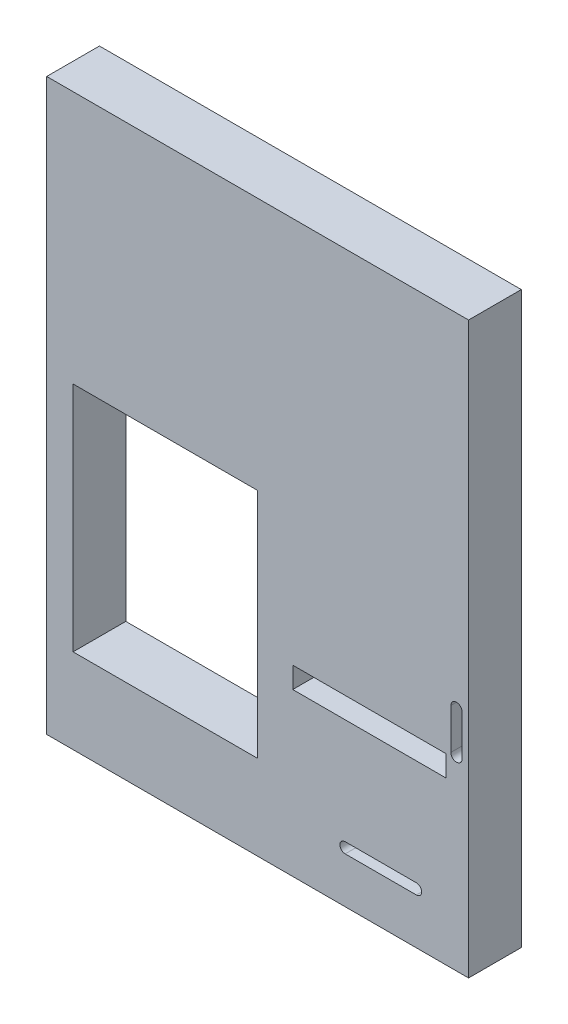
from build123d import *

# Parameters (mm, degrees)
SKETCH1_W           = 200
SKETCH1_H           = 240
BOSS_EXTRUDE3_DEPTH = 25
SKETCH3_W           = 87.5
SKETCH3_H           = 110
CUT_EXTRUDE1_DEPTH  = 25
SKETCH4_W           = 200
SKETCH4_H           = 30.164162566
BOSS_EXTRUDE4_DEPTH = 25
CUT_EXTRUDE3_DEPTH  = 40
CUT_EXTRUDE4_DEPTH  = 40
SKETCH8_W           = 72.718372575
SKETCH8_H           = 10
CUT_EXTRUDE5_DEPTH  = 40


with BuildPart() as part:
    # Sketch1 → Boss-Extrude3 (new body)
    with BuildSketch(Plane.XY):
        Rectangle(SKETCH1_W, SKETCH1_H)
    extrude(amount=BOSS_EXTRUDE3_DEPTH)

    # Sketch3 → Cut-Extrude1 (cut)
    with BuildSketch(Plane.XY.offset(25)):
        with Locations((-43.75, -55)):
            Rectangle(SKETCH3_W, SKETCH3_H)
    extrude(amount=-CUT_EXTRUDE1_DEPTH, mode=Mode.SUBTRACT)

    # Sketch4 → Boss-Extrude4 (add)
    with BuildSketch(Plane.XY.offset(25)):
        with Locations((0, -135.082081283)):
            Rectangle(SKETCH4_W, SKETCH4_H)
    extrude(amount=-BOSS_EXTRUDE4_DEPTH)

    # Sketch9 → Cut-Extrude3 (cut)
    with BuildSketch(Plane(origin=(0, 0, 0), x_dir=(-1, 0, 0), z_dir=(0, 0, -1))):
        with BuildLine():
            Line((-91.597538887, -42.469319431), (-91.597538887, -61.749189722))
            ThreePointArc((-91.597538887, -61.749189722), (-94.256831341, -64.408482175), (-96.916123795, -61.749189722))
            Line((-96.916123795, -61.749189722), (-96.916123795, -42.469319431))
            ThreePointArc((-96.916123795, -42.469319431), (-94.256831341, -39.810026977), (-91.597538887, -42.469319431))
        make_face()
    extrude(amount=-CUT_EXTRUDE3_DEPTH, mode=Mode.SUBTRACT)

    # Sketch10 → Cut-Extrude4 (cut)
    with BuildSketch(Plane(origin=(0, 0, 0), x_dir=(-1, 0, 0), z_dir=(0, 0, -1))):
        with BuildLine():
            Line((-75.267088852, -123.445469049), (-41.491938711, -123.445469049))
            ThreePointArc((-41.491938711, -123.445469049), (-38.991938711, -125.945469049), (-41.491938711, -128.445469049))
            Line((-41.491938711, -128.445469049), (-75.267088852, -128.445469049))
            ThreePointArc((-75.267088852, -128.445469049), (-77.767088852, -125.945469049), (-75.267088852, -123.445469049))
        make_face()
    extrude(amount=-CUT_EXTRUDE4_DEPTH, mode=Mode.SUBTRACT)

    # Sketch8 → Cut-Extrude5 (cut)
    with BuildSketch(Plane(origin=(0, 0, 0), x_dir=(-1, 0, 0), z_dir=(0, 0, -1))):
        with Locations((-53.00826824, -68.393983819)):
            Rectangle(SKETCH8_W, SKETCH8_H)
    extrude(amount=-CUT_EXTRUDE5_DEPTH, mode=Mode.SUBTRACT)


solid = part.part
